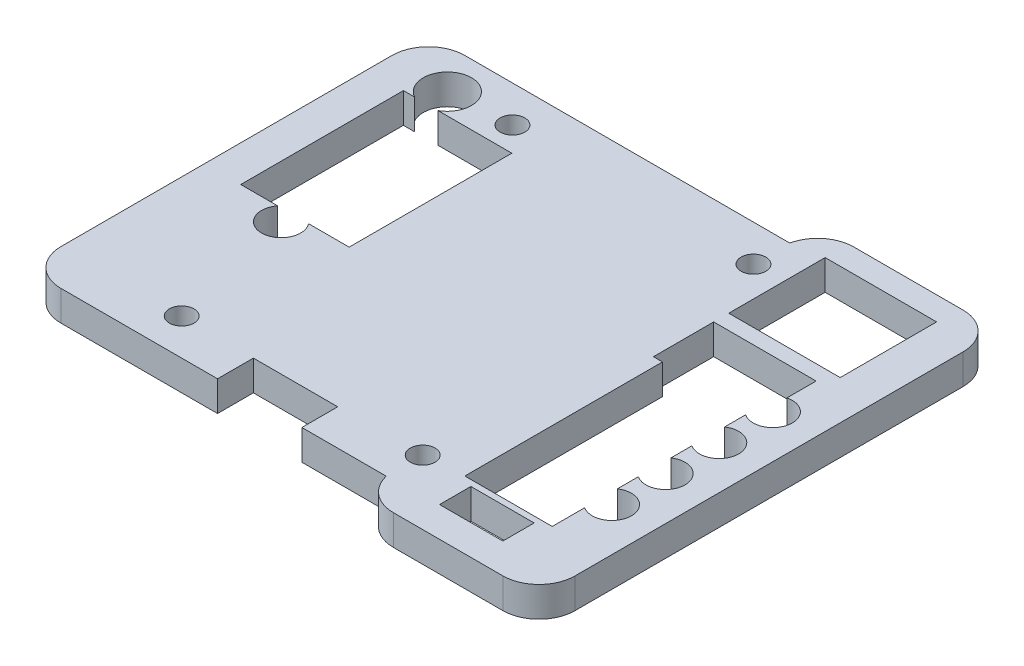
from build123d import *

# Parameters (mm, degrees)
SKETCH_2_R          = 6.05
SKETCH_2_R_2        = 2.05
EXTRUDE_1_DEPTH     = 5
EXTRUDE_1_2_DEPTH   = 5
EXTRUDE_1_3_DEPTH   = 5
EXTRUDE_1_4_DEPTH   = 5
SKETCH_6_R          = 2.05
EXTRUDE_1_5_DEPTH   = 5
SKETCH_8_W          = 18.5
SKETCH_8_H          = 16
SKETCH_8_W_2        = 10.5
SKETCH_8_H_2        = 5.2
SKETCH_8_W_3        = 14
SKETCH_8_H_3        = 9
CUT_EXTRUDE_2_DEPTH = 153.920706577


with BuildPart() as part:
    # 草图2 → Extrude 1 (new body)
    with BuildSketch(Plane(origin=(0, 0, 0), x_dir=(-1, 0, 0), z_dir=(0, -1, 0))):
        with Locations((-103.2, -9.35)):
            Circle(SKETCH_2_R)
        with Locations((-103.2, -9.35)):
            Circle(SKETCH_2_R_2, mode=Mode.SUBTRACT)
    extrude(amount=EXTRUDE_1_DEPTH)



with BuildPart() as body_2:
    # 草图2 → Extrude 1 2 (new body)
    with BuildSketch(Plane(origin=(0, 0, 0), x_dir=(-1, 0, 0), z_dir=(0, -1, 0))):
        with Locations((-63.2, -9.35)):
            Circle(SKETCH_2_R)
        with Locations((-63.2, -9.35)):
            Circle(SKETCH_2_R_2, mode=Mode.SUBTRACT)
    extrude(amount=EXTRUDE_1_2_DEPTH)


with BuildPart() as body_3:
    # 草图2 → Extrude 1 3 (new body)
    with BuildSketch(Plane(origin=(0, 0, 0), x_dir=(-1, 0, 0), z_dir=(0, -1, 0))):
        with Locations((-63.2, -64.25)):
            Circle(SKETCH_2_R)
        with Locations((-63.2, -64.25)):
            Circle(SKETCH_2_R_2, mode=Mode.SUBTRACT)
    extrude(amount=EXTRUDE_1_3_DEPTH)


with BuildPart() as body_4:
    # 草图2 → Extrude 1 4 (new body)
    with BuildSketch(Plane(origin=(0, 0, 0), x_dir=(-1, 0, 0), z_dir=(0, -1, 0))):
        with Locations((-103.2, -64.25)):
            Circle(SKETCH_2_R)
        with Locations((-103.2, -64.25)):
            Circle(SKETCH_2_R_2, mode=Mode.SUBTRACT)
    extrude(amount=EXTRUDE_1_4_DEPTH)


with BuildPart() as part_1:
    add(part.part)

    add(body_2.part)  # Extrude 1 5 merges body 2

    add(body_3.part)  # Extrude 1 5 merges body 3

    add(body_4.part)  # Extrude 1 5 merges body 4
    # 草图6 → Extrude 1 5 (add)
    with BuildSketch(Plane(origin=(0, 0, 0), x_dir=(1, 0, 0), z_dir=(0, 1, 0))):
        with BuildLine():
            Line((127.2, 1.45), (109.046152581, 1.45))
            ThreePointArc((109.046152581, 1.45), (105.271235363, 0.113689527), (103.177805284, -3.3))
            Line((103.177805284, -3.3), (63.2, -3.3))
            Line((63.2, -3.3), (49.25, -3.3))
            ThreePointArc((49.25, -3.3), (44.972003974, -5.072003974), (43.2, -9.35))
            Line((43.2, -9.35), (43.2, -64.3))
            ThreePointArc((43.2, -64.3), (44.957359313, -68.542640687), (49.2, -70.3))
            Line((49.2, -70.3), (103.2, -70.3))
            ThreePointArc((103.2, -70.3), (105.311182702, -73.645742753), (109.046152581, -74.95))
            Line((109.046152581, -74.95), (127.2, -74.95))
            ThreePointArc((127.2, -74.95), (131.442640687, -73.192640687), (133.2, -68.95))
            Line((133.2, -68.95), (133.2, -4.55))
            ThreePointArc((133.2, -4.55), (131.442640687, -0.307359313), (127.2, 1.45))
        make_face()
        with Locations(Location((103.2, -9.35, 0), (0, 0, 270))):
            Circle(SKETCH_6_R, mode=Mode.SUBTRACT)
        with Locations(Location((103.2, -64.25, 0), (0, 0, 270))):
            Circle(SKETCH_6_R, mode=Mode.SUBTRACT)
        with Locations(Location((63.2, -64.25, 0), (0, 0, 270))):
            Circle(SKETCH_6_R, mode=Mode.SUBTRACT)
        with Locations(Location((63.2, -9.35, 0), (0, 0, 90))):
            Circle(SKETCH_6_R, mode=Mode.SUBTRACT)
    extrude(amount=-EXTRUDE_1_5_DEPTH)

    # 草图8 → 切除-拉伸2 (cut, through all)
    with BuildSketch(Plane.XZ):
        with BuildLine():
            Line((67.2, 13.45), (67.2, 40.45))
            Line((67.2, 40.45), (60.461737691, 40.45))
            ThreePointArc((60.461737691, 40.45), (57.9, 45.7), (55.338262309, 40.45))
            Line((55.338262309, 40.45), (49.2, 40.45))
            Line((49.2, 40.45), (49.2, 13.45))
            Line((49.2, 13.45), (51.063508327, 13.45))
            ThreePointArc((51.063508327, 13.45), (53, 5.95), (54.936491673, 13.45))
            Line((54.936491673, 13.45), (67.2, 13.45))
        make_face()
        with Locations((117.45, 10.45)):
            Rectangle(SKETCH_8_W, SKETCH_8_H)
        with BuildLine():
            Line((108.2, 20.95), (125.2, 20.95))
            Line((125.2, 20.95), (125.2, 25.8))
            ThreePointArc((125.2, 25.8), (129.203625856, 29.497066152), (124.2, 31.656011826))
            Line((124.2, 31.656011826), (124.2, 35.143988174))
            ThreePointArc((124.2, 35.143988174), (129.25, 37.85), (124.2, 40.556011826))
            Line((124.2, 40.556011826), (124.2, 44.043988174))
            ThreePointArc((124.2, 44.043988174), (129.25, 46.75), (124.2, 49.456011826))
            Line((124.2, 49.456011826), (124.2, 52.943988174))
            ThreePointArc((124.2, 52.943988174), (129.25, 55.65), (124.2, 58.356011826))
            Line((124.2, 58.356011826), (124.2, 63.75))
            Line((124.2, 63.75), (122.2, 63.75))
            Line((122.2, 63.75), (111.7, 63.75))
            Line((111.7, 63.75), (109.7, 63.75))
            Line((109.7, 63.75), (109.7, 30.95))
            Line((109.7, 30.95), (108.2, 30.95))
            Line((108.2, 30.95), (108.2, 20.95))
        make_face()
        with Locations((116.95, 67.35)):
            Rectangle(SKETCH_8_W_2, SKETCH_8_H_2)
        with Locations((82.2, 68.85)):
            Rectangle(SKETCH_8_W_3, SKETCH_8_H_3)
    extrude(amount=CUT_EXTRUDE_2_DEPTH, mode=Mode.SUBTRACT)


solid = part_1.part
